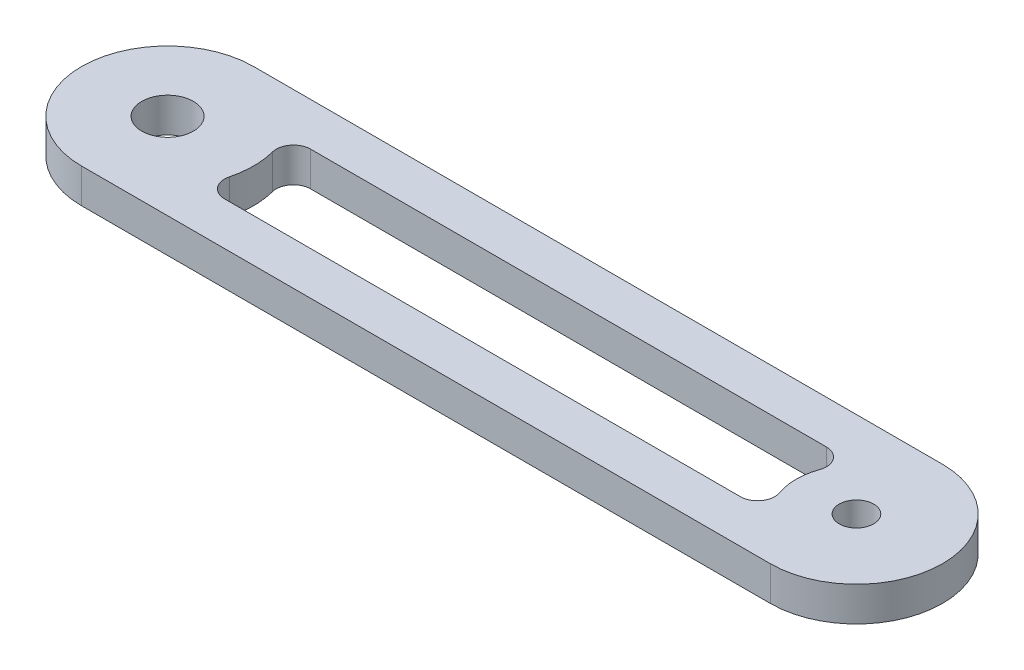
from build123d import *

# Parameters (mm, degrees)
BOSS_EXTRUDE1_DEPTH = 2
SKETCH4_R           = 1
CUT_EXTRUDE3_DEPTH  = 12.7
SKETCH5_R           = 1.5
CUT_EXTRUDE4_DEPTH  = 10
CUT_EXTRUDE5_REACH  = 27.573


with BuildPart() as part:
    # Sketch1 → Boss-Extrude1 (new body)
    with BuildSketch(Plane(origin=(0, 0, 0), x_dir=(1, 0, 0), z_dir=(0, 1, 0))):
        with BuildLine():
            Line((-20, 5), (20, 5))
            ThreePointArc((20, 5), (25, 0), (20, -5))
            Line((20, -5), (-20, -5))
            ThreePointArc((-20, -5), (-25, 0), (-20, 5))
        make_face()
    extrude(amount=BOSS_EXTRUDE1_DEPTH)

    # Sketch4 → Cut-Extrude3 (cut)
    with BuildSketch(Plane(origin=(0, 2, 0), x_dir=(1, 0, 0), z_dir=(0, 1, 0))):
        with Locations(Location((20, 0, 0), (0, 0, 270))):
            Circle(SKETCH4_R)
    extrude(amount=-CUT_EXTRUDE3_DEPTH, mode=Mode.SUBTRACT)

    # Sketch5 → Cut-Extrude4 (cut)
    with BuildSketch(Plane(origin=(0, 2, 0), x_dir=(1, 0, 0), z_dir=(0, 1, 0))):
        with Locations(Location((-20, 0, 0), (0, 0, 270))):
            Circle(SKETCH5_R)
    extrude(amount=-CUT_EXTRUDE4_DEPTH, mode=Mode.SUBTRACT)

    # Sketch6 → Cut-Extrude5 (cut, up to next)
    with BuildSketch(Plane.XZ, mode=Mode.PRIVATE) as cut_extrude5_sk1:
        with BuildLine():
            Line((15.757359313, -2.5), (-14.190524981, -2.5))
            ThreePointArc((-14.190524981, -2.5), (-14.981094396, -2.112372436), (-15.158770817, -1.25))
            ThreePointArc((-15.158770817, -1.25), (-15, 0), (-15.158770817, 1.25))
            ThreePointArc((-15.158770817, 1.25), (-14.981094396, 2.112372436), (-14.190524981, 2.5))
            Line((-14.190524981, 2.5), (15.757359313, 2.5))
            ThreePointArc((15.757359313, 2.5), (16.573855894, 2.077350269), (16.700168354, 1.166666667))
            ThreePointArc((16.700168354, 1.166666667), (16.5, 0), (16.700168354, -1.166666667))
            ThreePointArc((16.700168354, -1.166666667), (16.573855894, -2.077350269), (15.757359313, -2.5))
        make_face()
    cut_extrude5_tool1 = extrude(cut_extrude5_sk1.sketch, amount=-CUT_EXTRUDE5_REACH, mode=Mode.PRIVATE) & part.part
    add(cut_extrude5_tool1.solids().sort_by_distance((0.772522, 0, 0))[0], mode=Mode.SUBTRACT)


solid = part.part
